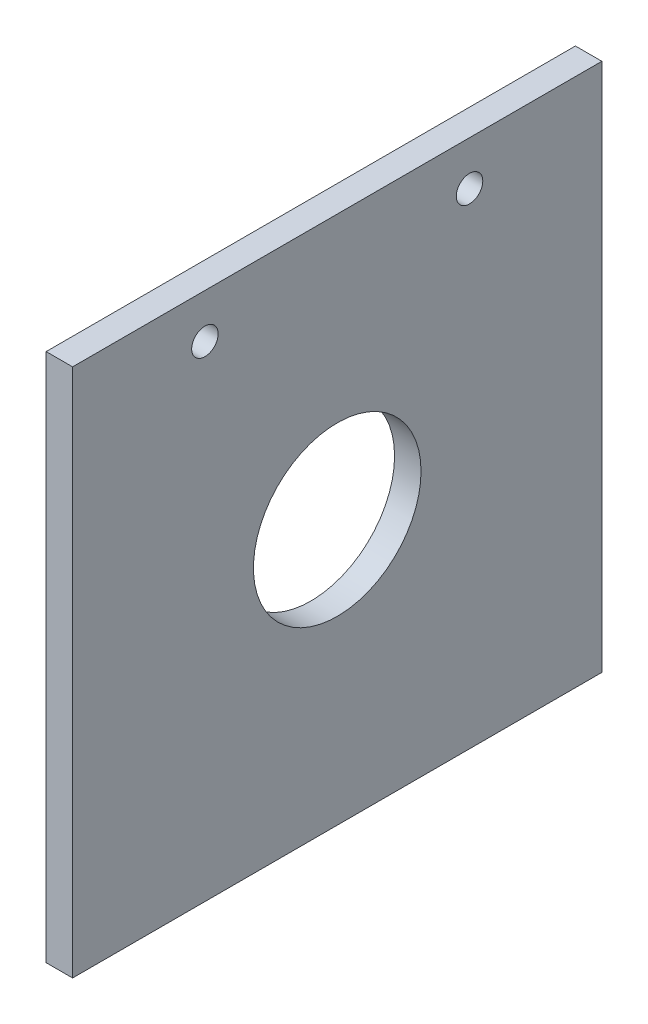
from build123d import *

# Parameters (mm, degrees)
SKIZZE1_W                       = 60
SKIZZE1_H                       = 60
AUFSATZ_LINEAR_AUSTRAGEN1_DEPTH = 3
SKIZZE3_R                       = 1.5
SKIZZE3_R_2                     = 9.5
SCHNITT_LINEAR_AUSTRAGEN2_DEPTH = 43.532340636


with BuildPart() as part:
    # Skizze1 → Aufsatz-Linear austragen1 (new body)
    with BuildSketch(Plane(origin=(0, 0, 0), x_dir=(0, 0, -1), z_dir=(1, 0, 0))):
        Rectangle(SKIZZE1_W, SKIZZE1_H)
    extrude(amount=AUFSATZ_LINEAR_AUSTRAGEN1_DEPTH)

    # Skizze3 → Schnitt-Linear austragen2 (cut, through all)
    with BuildSketch(Plane(origin=(3, 0, 0), x_dir=(0, 0, -1), z_dir=(1, 0, 0))):
        with Locations((-15, 25)):
            Circle(SKIZZE3_R)
        with Locations((15, 25)):
            Circle(SKIZZE3_R)
        Circle(SKIZZE3_R_2)
    extrude(amount=-SCHNITT_LINEAR_AUSTRAGEN2_DEPTH, mode=Mode.SUBTRACT)


solid = part.part
